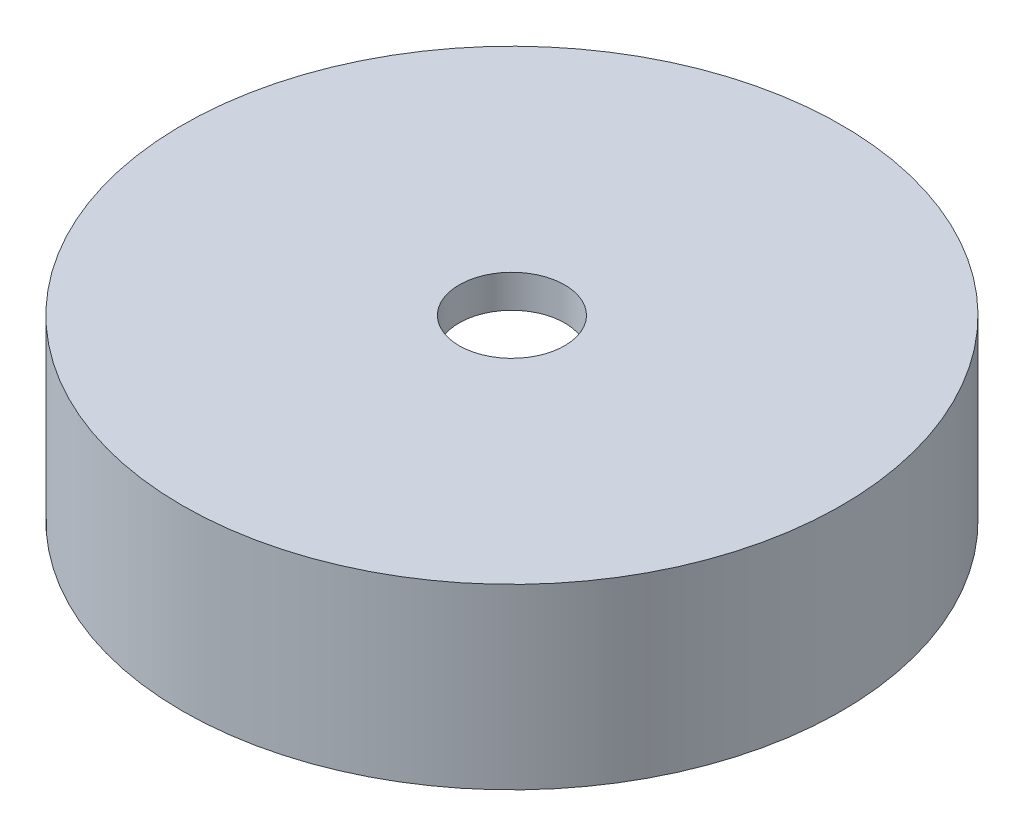
from build123d import *

# Parameters (mm, degrees)
SKETCH1_R           = 50
SKETCH1_R_2         = 45
BOSS_EXTRUDE1_DEPTH = 22
SKETCH2_R           = 50
SKETCH2_R_2         = 45
SKETCH2_R_3         = 8
BOSS_EXTRUDE2_DEPTH = 5


with BuildPart() as part:
    # Sketch1 → Boss-Extrude1 (new body)
    with BuildSketch(Plane(origin=(0, 0, 0), x_dir=(1, 0, 0), z_dir=(0, 1, 0))):
        with Locations(Location((0, 0, 0), (0, 0, 270))):
            Circle(SKETCH1_R)
        with Locations(Location((0, 0, 0), (0, 0, 270))):
            Circle(SKETCH1_R_2, mode=Mode.SUBTRACT)
    extrude(amount=BOSS_EXTRUDE1_DEPTH)

    # Sketch2 → Boss-Extrude2 (add)
    # profile 1 of 2: a face of its own
    with BuildSketch(Plane(origin=(0, 22, 0), x_dir=(1, 0, 0), z_dir=(0, 1, 0))):
        with Locations(Location((0, 0, 0), (0, 0, 270))):
            Circle(SKETCH2_R)
        with Locations(Location((0, 0, 0), (0, 0, 270))):
            Circle(SKETCH2_R_2, mode=Mode.SUBTRACT)
    # profile 2 of 2: a face of its own
    with BuildSketch(Plane(origin=(0, 22, 0), x_dir=(1, 0, 0), z_dir=(0, 1, 0))):
        with Locations(Location((0, 0, 0), (0, 0, 270))):
            Circle(SKETCH2_R_2)
        with Locations(Location((0, 0, 0), (0, 0, 270))):
            Circle(SKETCH2_R_3, mode=Mode.SUBTRACT)
    extrude(amount=BOSS_EXTRUDE2_DEPTH)


solid = part.part
